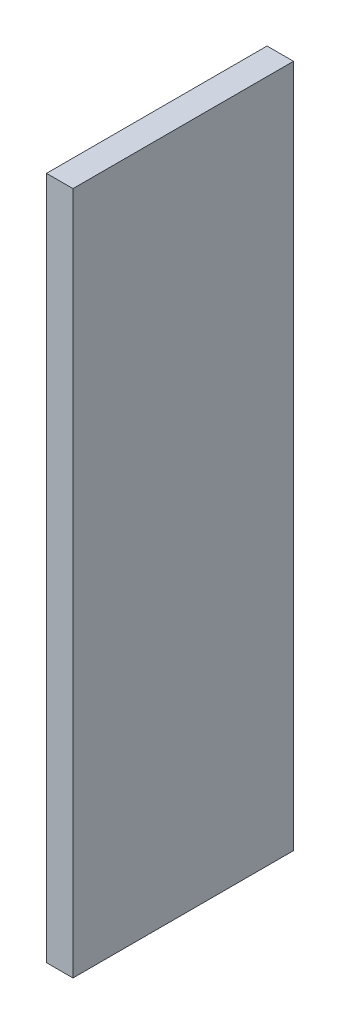
from build123d import *

# Parameters (mm, degrees)
SKETCH1_W           = 155
SKETCH1_H           = 50
BOSS_EXTRUDE1_DEPTH = 6


with BuildPart() as part:
    # Sketch1 → Boss-Extrude1 (new body)
    with BuildSketch(Plane.YZ):
        with Locations((77.5, 25)):
            Rectangle(SKETCH1_W, SKETCH1_H)
    extrude(amount=BOSS_EXTRUDE1_DEPTH)


solid = part.part
